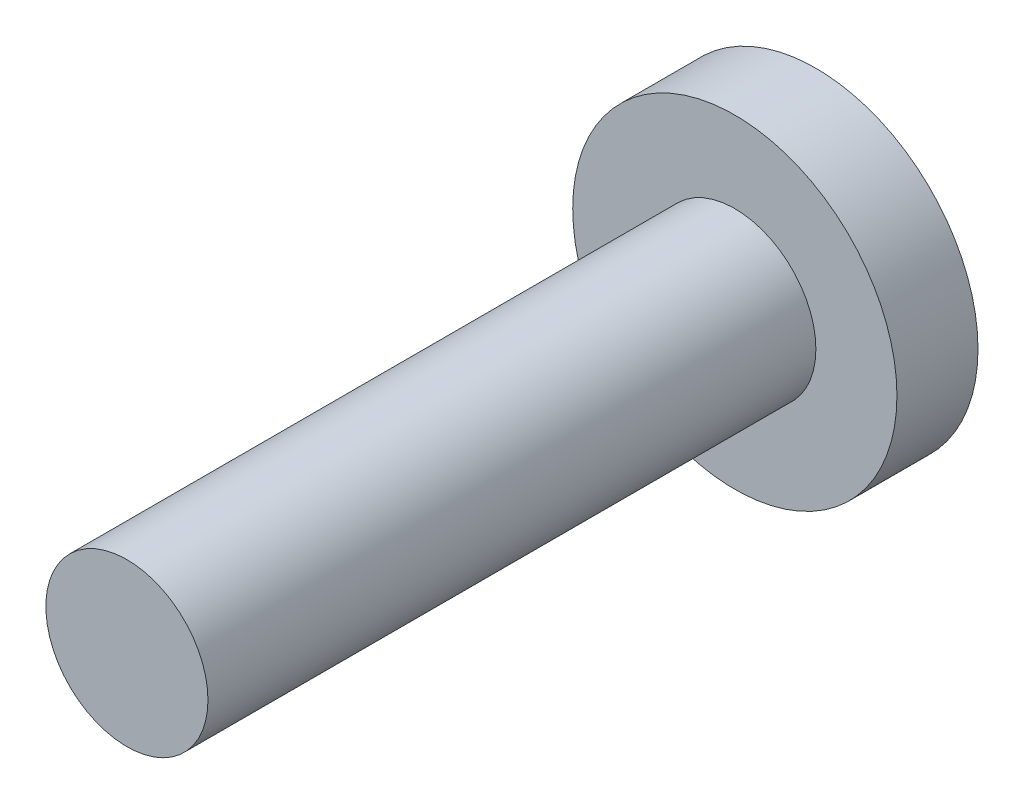
from build123d import *

# Parameters (mm, degrees)
REFERENCE_HEAD_START  = -1
SKETCH1_R             = 2
REFERENCE_HEAD_DEPTH  = 1
SKETCH2_R             = 1
REFERENCE_SHANK_DEPTH = 7.5


with BuildPart() as part:
    # Sketch1 → Reference_Head (new body)
    with BuildSketch(Plane.XY.offset(REFERENCE_HEAD_START)):
        Circle(SKETCH1_R)
    extrude(amount=REFERENCE_HEAD_DEPTH)

    # Sketch2 → Reference_Shank (add)
    with BuildSketch(Plane.XY):
        Circle(SKETCH2_R)
    extrude(amount=REFERENCE_SHANK_DEPTH)


solid = part.part
